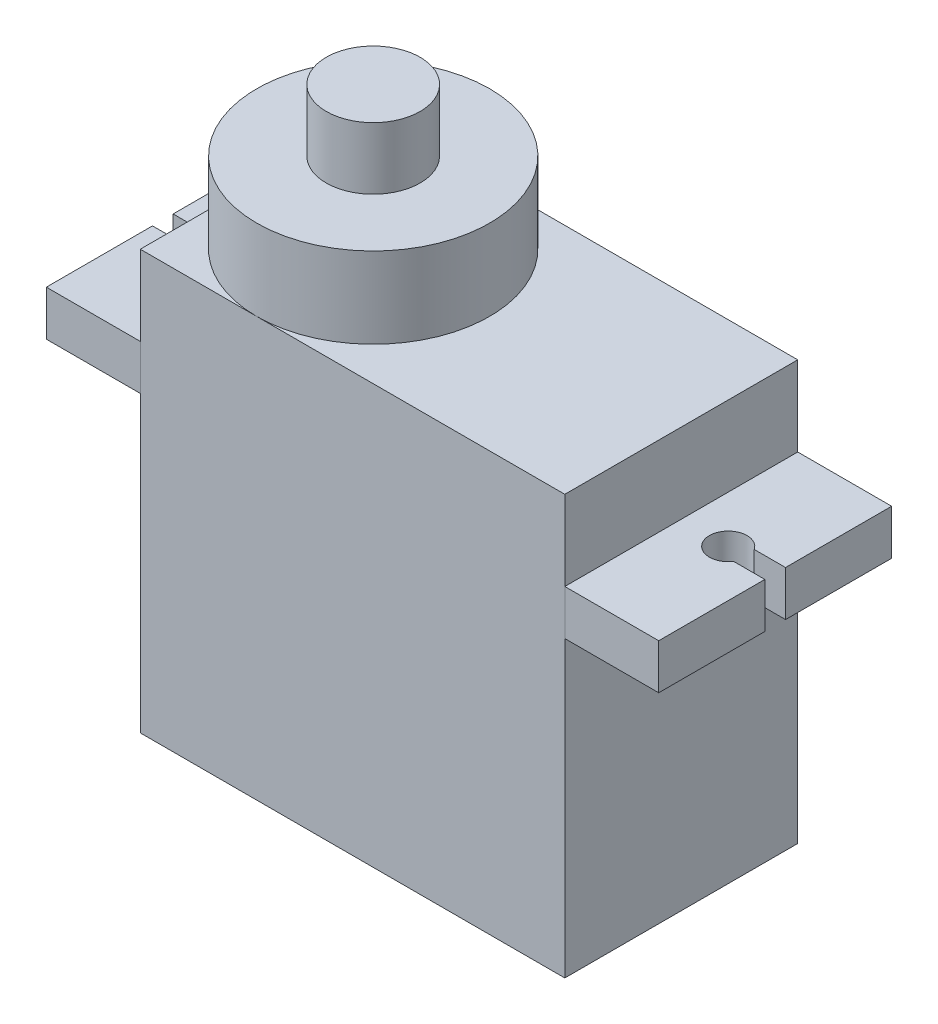
from build123d import *

# Parameters (mm, degrees)
SKETCH_1_W          = 22.6
SKETCH_1_H          = 12.4
EXTRUDE_1_DEPTH     = 22.3
SKETCH_2_W          = 5
SKETCH_2_H          = 2.4
EXTRUDE_2_DEPTH     = 12.4
EXTRUDE_2_2_DEPTH   = 12.4
CUT_EXTRUDE_1_DEPTH = 26.098456128
SKETCH_4_R          = 6.2
EXTRUDE_3_DEPTH     = 4.3
SKETCH_5_R          = 2.5
EXTRUDE_4_DEPTH     = 3.3
SKETCH_6_R          = 0.6
EXTRUDE_8_DEPTH     = 2.3
EXTRUDE_8_2_DEPTH   = 2.3
EXTRUDE_8_3_DEPTH   = 2.3


with BuildPart() as part:
    # 草图1 → 凸台-拉伸1 (new body)
    with BuildSketch(Plane(origin=(0, 0, 0), x_dir=(1, 0, 0), z_dir=(0, 1, 0))):
        Rectangle(SKETCH_1_W, SKETCH_1_H)
    extrude(amount=EXTRUDE_1_DEPTH)

    # 草图4 → 凸台-拉伸3 (add)
    with BuildSketch(Plane(origin=(0, 22.3, 0), x_dir=(1, 0, 0), z_dir=(0, 1, 0))):
        with Locations(Location((-5.1, 0, 0), (0, 0, 270))):
            Circle(SKETCH_4_R)
    extrude(amount=EXTRUDE_3_DEPTH)

    # 草图5 → 凸台-拉伸4 (add)
    with BuildSketch(Plane(origin=(0, 26.6, 0), x_dir=(1, 0, 0), z_dir=(0, 1, 0))):
        with Locations(Location((-5.1, 0, 0), (0, 0, 270))):
            Circle(SKETCH_5_R)
    extrude(amount=EXTRUDE_4_DEPTH)


with BuildPart() as body_2:
    # 草图2 → 凸台-拉伸2 (new, through all)
    with BuildSketch(Plane.XY.offset(6.2)):
        with Locations((13.8, 16.85)):
            Rectangle(SKETCH_2_W, SKETCH_2_H)
    extrude(amount=-EXTRUDE_2_DEPTH)


with BuildPart() as body_3:
    # 草图2 → Extrude 2 2 (new, through all)
    with BuildSketch(Plane.XY.offset(6.2)):
        with Locations((-13.8, 16.85)):
            Rectangle(SKETCH_2_W, SKETCH_2_H)
    extrude(amount=-EXTRUDE_2_2_DEPTH)


with BuildPart() as cut_extrude_1_tool:
    # 草图3 → 切除-拉伸1 (new, through all)
    with BuildSketch(Plane(origin=(0, 18.05, 0), x_dir=(1, 0, 0), z_dir=(0, 1, 0))):
        with BuildLine():
            Line((14.635164654, 0.55), (16.3, 0.55))
            Line((16.3, 0.55), (16.3, -0.55))
            Line((16.3, -0.55), (14.635164654, -0.55))
            ThreePointArc((14.635164654, -0.55), (12.8, 0), (14.635164654, 0.55))
        make_face()
        with BuildLine():
            Line((-14.635164654, -0.55), (-16.3, -0.55))
            Line((-16.3, -0.55), (-16.3, 0.55))
            Line((-16.3, 0.55), (-14.635164654, 0.55))
            ThreePointArc((-14.635164654, 0.55), (-12.8, 0), (-14.635164654, -0.55))
        make_face()
    extrude(amount=-CUT_EXTRUDE_1_DEPTH)


with BuildPart() as body_2_1:
    add(body_2.part)

    # 切除-拉伸1: cut by cut_extrude_1_tool
    add(cut_extrude_1_tool.part, mode=Mode.SUBTRACT)


with BuildPart() as body_3_1:
    add(body_3.part)

    # 切除-拉伸1: cut by cut_extrude_1_tool
    add(cut_extrude_1_tool.part, mode=Mode.SUBTRACT)


with BuildPart() as body_4:
    # 草图6 → 凸台-拉伸8 (new body)
    with BuildSketch(Plane.ZY.offset(11.3)):
        with Locations((0, 4.5)):
            Circle(SKETCH_6_R)
    extrude(amount=EXTRUDE_8_DEPTH)


with BuildPart() as body_5:
    # 草图6 → Extrude 8 2 (new body)
    with BuildSketch(Plane.ZY.offset(11.3)):
        with Locations((1.2, 4.5)):
            Circle(SKETCH_6_R)
    extrude(amount=EXTRUDE_8_2_DEPTH)


with BuildPart() as body_6:
    # 草图6 → Extrude 8 3 (new body)
    with BuildSketch(Plane.ZY.offset(11.3)):
        with Locations((-1.2, 4.5)):
            Circle(SKETCH_6_R)
    extrude(amount=EXTRUDE_8_3_DEPTH)


solid = Compound([part.part, body_2_1.part, body_3_1.part, body_4.part, body_5.part, body_6.part])
